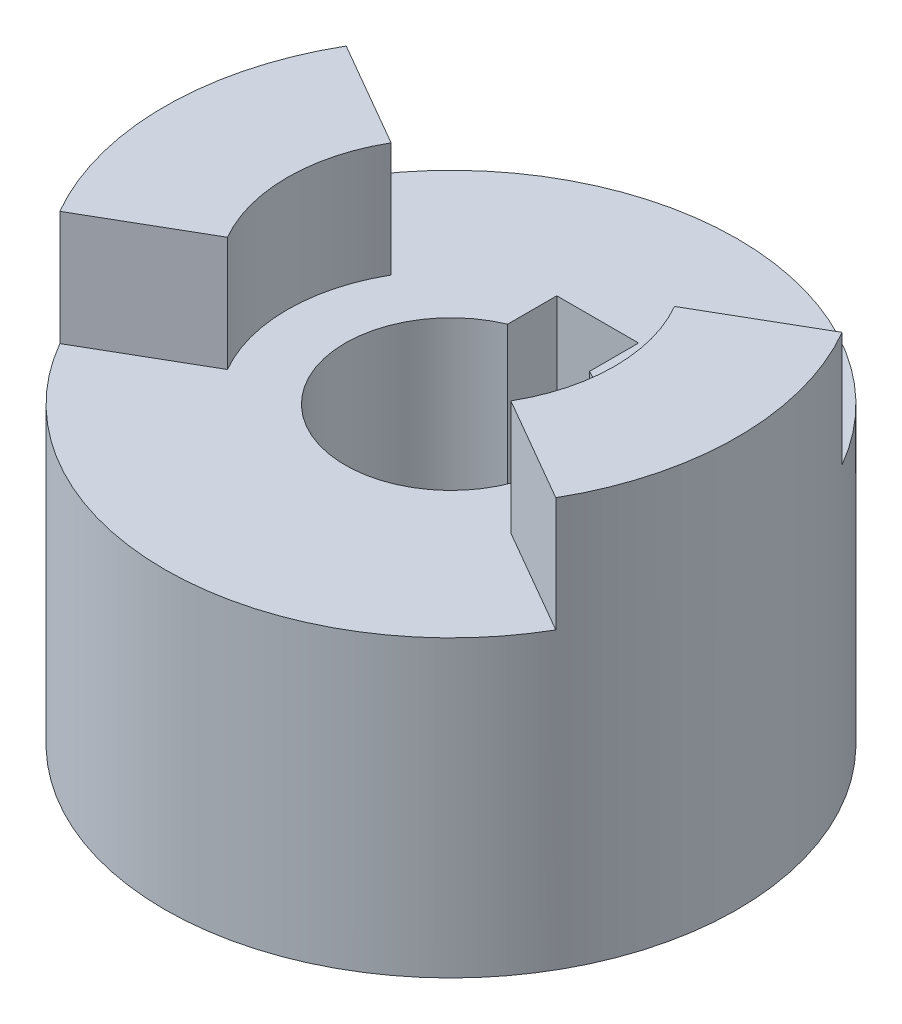
from build123d import *

# Parameters (mm, degrees)
SKETCH1_R           = 35
BOSS_EXTRUDE1_DEPTH = 50
CUT_EXTRUDE1_START  = -14
CUT_EXTRUDE1_DEPTH  = 14
CUT_EXTRUDE2_DEPTH  = 71.356236397
CUT_EXTRUDE8_START  = 36
SKETCH10_R          = 20
CUT_EXTRUDE8_DEPTH  = 35.356236397


with BuildPart() as part:
    # Sketch1 → Boss-Extrude1 (new body)
    with BuildSketch(Plane(origin=(0, 0, 0), x_dir=(1, 0, 0), z_dir=(0, 1, 0))):
        with Locations(Location((0, 0, 0), (0, 0, 270))):
            Circle(SKETCH1_R)
    extrude(amount=BOSS_EXTRUDE1_DEPTH)

    # Sketch2 → Cut-Extrude1 (cut)
    with BuildSketch(Plane(origin=(0, 50, 0), x_dir=(1, 0, 0), z_dir=(0, 1, 0)).offset(CUT_EXTRUDE1_START)):
        with BuildLine():
            Line((-10.392304845, -6), (-30.310889132, -17.5))
            ThreePointArc((-30.310889132, -17.5), (0, -35), (30.310889132, -17.5))
            Line((30.310889132, -17.5), (10.392304845, -6))
            ThreePointArc((10.392304845, -6), (0, -12), (-10.392304845, -6))
        make_face()
    cut_extrude1 = extrude(amount=CUT_EXTRUDE1_DEPTH, mode=Mode.SUBTRACT)

    # Mirror2: Cut-Extrude1 across plane
    add(cut_extrude1.mirror(Plane.XY), mode=Mode.SUBTRACT)

    # Sketch3 → Cut-Extrude2 (cut, through all)
    with BuildSketch(Plane(origin=(0, 0, 0), x_dir=(1, 0, 0), z_dir=(0, 1, 0))):
        with BuildLine():
            Line((5, 11.924130996), (5, 17.93))
            Line((5, 17.93), (-5, 17.93))
            Line((-5, 17.93), (-5, 11.924130996))
            ThreePointArc((-5, 11.924130996), (0, -12.93), (5, 11.924130996))
        make_face()
    extrude(amount=CUT_EXTRUDE2_DEPTH, mode=Mode.SUBTRACT)

    # Sketch10 → Cut-Extrude8 (cut, through all)
    with BuildSketch(Plane(origin=(0, 0, 0), x_dir=(1, 0, 0), z_dir=(0, 1, 0)).offset(CUT_EXTRUDE8_START)):
        Circle(SKETCH10_R)
    extrude(amount=CUT_EXTRUDE8_DEPTH, mode=Mode.SUBTRACT)


solid = part.part
